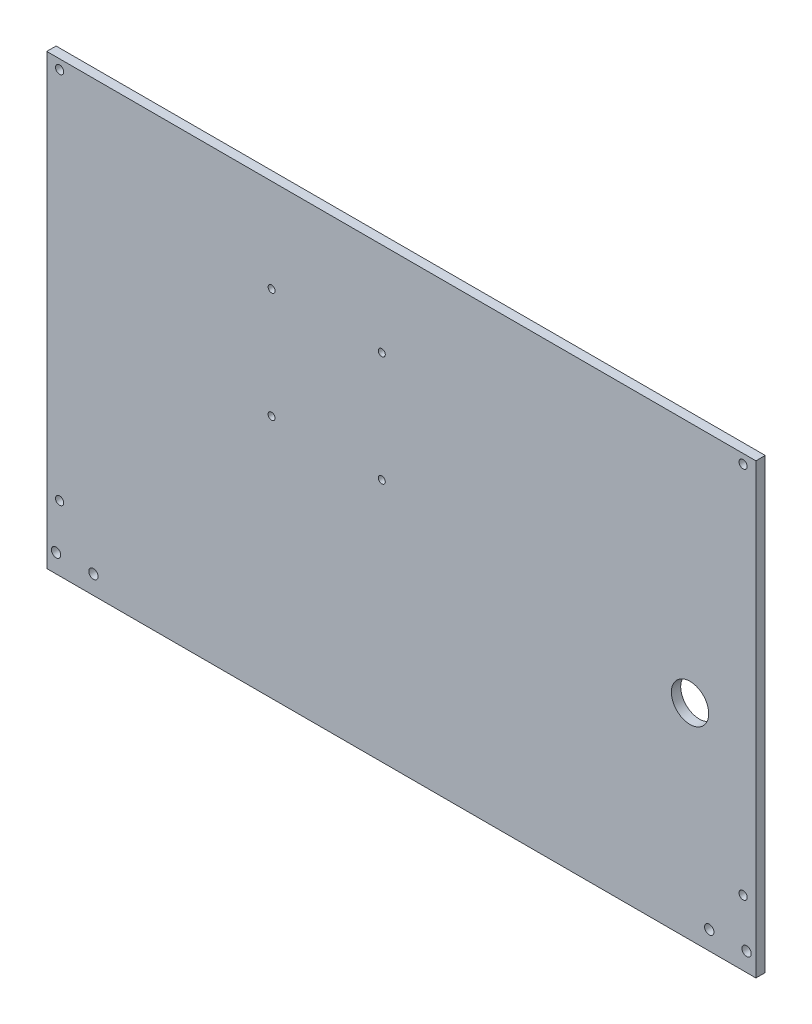
from build123d import *

# Parameters (mm, degrees)
SKETCH1_W           = 482.6
SKETCH1_H           = 304.8
BOSS_EXTRUDE1_DEPTH = 6.35
SKETCH2_R           = 2.7813
CUT_EXTRUDE1_DEPTH  = 286.467638271
SKETCH3_R           = 3.175
CUT_EXTRUDE2_DEPTH  = 286.467638271
SKETCH4_R           = 12.7
CUT_EXTRUDE3_DEPTH  = 286.467638271
SKETCH5_R           = 2.3749
CUT_EXTRUDE4_DEPTH  = 286.467638271


with BuildPart() as part:
    # Sketch1 → Boss-Extrude1 (new body)
    with BuildSketch(Plane.XY):
        Rectangle(SKETCH1_W, SKETCH1_H)
    extrude(amount=BOSS_EXTRUDE1_DEPTH)

    # Sketch2 → Cut-Extrude1 (cut, through all)
    with BuildSketch(Plane.XY.offset(6.35)):
        with Locations((-232.5624, 146.05)):
            Circle(SKETCH2_R)
        with Locations((-232.5624, -107.95)):
            Circle(SKETCH2_R)
    cut_extrude1 = extrude(amount=-CUT_EXTRUDE1_DEPTH, mode=Mode.SUBTRACT)

    # Mirror1: Cut-Extrude1 across plane
    add(cut_extrude1.mirror(Plane(origin=(0, 0, 0), x_dir=(0, 0, 1), z_dir=(1, 0, 0))), mode=Mode.SUBTRACT)

    # Sketch3 → Cut-Extrude2 (cut, through all)
    with BuildSketch(Plane.XY.offset(6.35)):
        with Locations((-234.95, -139.7)):
            Circle(SKETCH3_R)
        with Locations((-209.55, -139.7)):
            Circle(SKETCH3_R)
    cut_extrude2 = extrude(amount=-CUT_EXTRUDE2_DEPTH, mode=Mode.SUBTRACT)

    # Mirror2: Cut-Extrude2 across plane
    add(cut_extrude2.mirror(Plane(origin=(0, 0, 0), x_dir=(0, 0, 1), z_dir=(1, 0, 0))), mode=Mode.SUBTRACT)

    # Sketch4 → Cut-Extrude3 (cut, through all)
    with BuildSketch(Plane.XY.offset(6.35)):
        with Locations((196.469, -12.7)):
            Circle(SKETCH4_R)
    extrude(amount=-CUT_EXTRUDE3_DEPTH, mode=Mode.SUBTRACT)

    # Sketch5 → Cut-Extrude4 (cut, through all)
    with BuildSketch(Plane.XY.offset(6.35)):
        with Locations((-88.3, 88.9)):
            Circle(SKETCH5_R)
        with Locations((-13.3, 88.9)):
            Circle(SKETCH5_R)
        with Locations((-13.3, 13.9)):
            Circle(SKETCH5_R)
        with Locations((-88.3, 13.9)):
            Circle(SKETCH5_R)
    extrude(amount=-CUT_EXTRUDE4_DEPTH, mode=Mode.SUBTRACT)


solid = part.part
